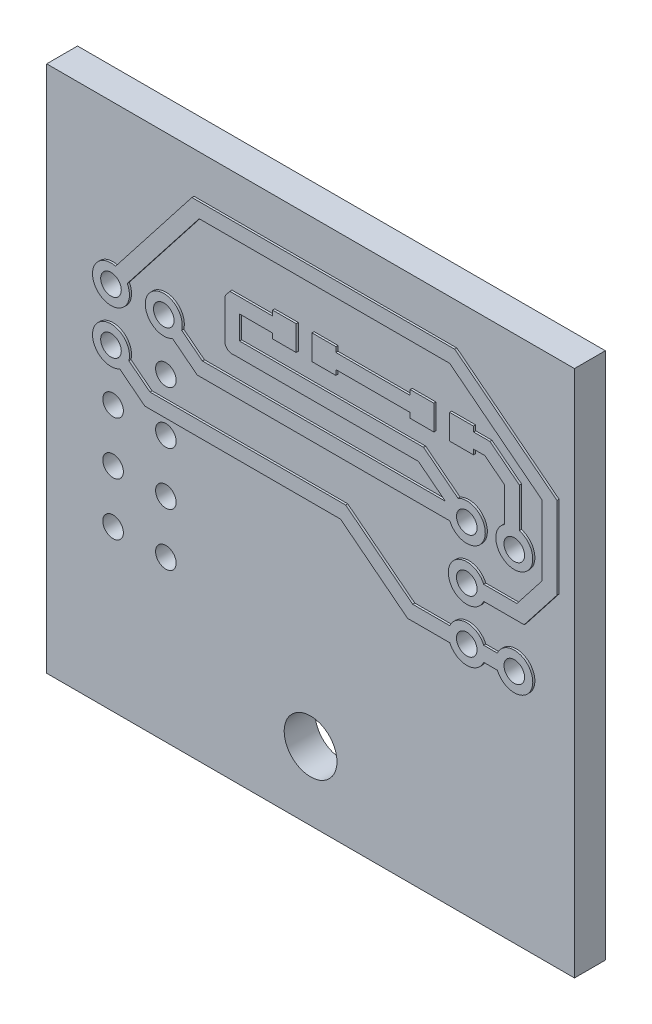
from build123d import *

# Parameters (mm, degrees)
SKETCH1_W           = 25.4
SKETCH1_H           = 25.4
BOSS_EXTRUDE1_DEPTH = 1.5875
SKETCH2_R           = 0.4953
CUT_EXTRUDE1_DEPTH  = 2.54
SKETCH4_R           = 0.4953
CUT_EXTRUDE2_DEPTH  = 2.54
SKETCH5_W           = 25.4
SKETCH5_H           = 25.4
SKETCH5_R           = 0.4953
CUT_EXTRUDE4_DEPTH  = 0.1016
SKETCH6_R           = 1.27
CUT_EXTRUDE5_DEPTH  = 2.54


with BuildPart() as part:
    # Sketch1 → Boss-Extrude1 (new body)
    with BuildSketch(Plane.XY):
        Rectangle(SKETCH1_W, SKETCH1_H)
    extrude(amount=BOSS_EXTRUDE1_DEPTH)

    # Sketch2 → Cut-Extrude1 (cut)
    with BuildSketch(Plane.XY.offset(1.5875)):
        with Locations((-9.503137046, 5.16324298)):
            Circle(SKETCH2_R)
        with Locations((-6.963137046, 5.16324298)):
            Circle(SKETCH2_R)
        with Locations((-9.503137046, 2.62324298)):
            Circle(SKETCH2_R)
        with Locations((-6.963137046, 2.62324298)):
            Circle(SKETCH2_R)
        with Locations((-9.503137046, 0.08324298)):
            Circle(SKETCH2_R)
        with Locations((-6.963137046, 0.08324298)):
            Circle(SKETCH2_R)
        with Locations((-9.503137046, -2.45675702)):
            Circle(SKETCH2_R)
        with Locations((-6.963137046, -2.45675702)):
            Circle(SKETCH2_R)
        with Locations((-9.503137046, -4.99675702)):
            Circle(SKETCH2_R)
        with Locations((-6.963137046, -4.99675702)):
            Circle(SKETCH2_R)
    extrude(amount=-CUT_EXTRUDE1_DEPTH, mode=Mode.SUBTRACT)

    # Sketch4 → Cut-Extrude2 (cut)
    with BuildSketch(Plane.XY.offset(1.5875)):
        with Locations((7.62, 3.81)):
            Circle(SKETCH4_R)
        with Locations((7.62, 1.27)):
            Circle(SKETCH4_R)
        with Locations((7.62, -1.27)):
            Circle(SKETCH4_R)
        with Locations((9.906, -1.27)):
            Circle(SKETCH4_R)
        with Locations((9.906, 3.81)):
            Circle(SKETCH4_R)
    extrude(amount=-CUT_EXTRUDE2_DEPTH, mode=Mode.SUBTRACT)

    # Sketch5 → Cut-Extrude4 (cut)
    with BuildSketch(Plane.XY.offset(1.5875)):
        Rectangle(SKETCH5_W, SKETCH5_H)
        with BuildLine():
            Line((-5.260680936, 10.015749034), (-8.721290559, 5.586370704))
            ThreePointArc((-8.721290559, 5.586370704), (-10.050460097, 4.46270142), (-9.281723807, 6.024229146))
            Line((-9.281723807, 6.024229146), (-5.607556352, 10.726949034))
            Line((-5.607556352, 10.726949034), (7.041908164, 10.726949034))
            Line((7.041908164, 10.726949034), (11.959875981, 6.884611467))
            Line((11.959875981, 6.884611467), (11.959875981, 2.935863527))
            Line((11.959875981, 2.935863527), (10.380535583, 0.9144))
            Line((10.380535583, 0.9144), (8.434781959, 0.9144))
            ThreePointArc((8.434781959, 0.9144), (6.731, 1.27), (8.434781959, 1.6256))
            Line((8.434781959, 1.6256), (10.033660166, 1.6256))
            Line((10.033660166, 1.6256), (11.248675981, 3.180749326))
            Line((11.248675981, 3.180749326), (11.248675981, 6.53773605))
            Line((11.248675981, 6.53773605), (6.797022365, 10.015749034))
            Line((6.797022365, 10.015749034), (-5.260680936, 10.015749034))
        make_face(mode=Mode.SUBTRACT)
        with BuildLine():
            Line((-8.64215088, 2.401829741), (-7.627203971, 1.60886631))
            Line((-7.627203971, 1.60886631), (1.787159337, 1.60886631))
            Line((1.787159337, 1.60886631), (5.016792936, -0.9144))
            Line((5.016792936, -0.9144), (6.805218041, -0.9144))
            ThreePointArc((6.805218041, -0.9144), (7.62, -0.381), (8.434781959, -0.9144))
            Line((8.434781959, -0.9144), (9.091218041, -0.9144))
            ThreePointArc((9.091218041, -0.9144), (10.795, -1.27), (9.091218041, -1.6256))
            Line((9.091218041, -1.6256), (8.434781959, -1.6256))
            ThreePointArc((8.434781959, -1.6256), (7.62, -2.159), (6.805218041, -1.6256))
            Line((6.805218041, -1.6256), (4.771907137, -1.6256))
            Line((4.771907137, -1.6256), (1.542273539, 0.89766631))
            Line((1.542273539, 0.89766631), (-7.87208977, 0.89766631))
            Line((-7.87208977, 0.89766631), (-9.080009321, 1.841396493))
            ThreePointArc((-9.080009321, 1.841396493), (-10.203678606, 3.170566031), (-8.64215088, 2.401829741))
        make_face(mode=Mode.SUBTRACT)
        with BuildLine():
            Line((9.441579604, 4.622540959), (9.441579604, 6.272789394))
            Line((9.441579604, 6.272789394), (8.487506715, 7.018192829))
            Line((8.487506715, 7.018192829), (7.944356637, 7.018192829))
            Line((7.944356637, 7.018192829), (7.944356637, 6.773792829))
            Line((7.944356637, 6.773792829), (6.794350037, 6.773792829))
            Line((6.794350037, 6.773792829), (6.794350037, 7.973792829))
            Line((6.794350037, 7.973792829), (7.944356637, 7.973792829))
            Line((7.944356637, 7.973792829), (7.944356637, 7.729392829))
            Line((7.944356637, 7.729392829), (8.732392514, 7.729392829))
            Line((8.732392514, 7.729392829), (10.152779604, 6.619664811))
            Line((10.152779604, 6.619664811), (10.152779604, 4.718555699))
            ThreePointArc((10.152779604, 4.718555699), (10.024939422, 2.983486714), (9.441579604, 4.622540959))
        make_face(mode=Mode.SUBTRACT)
        with Locations((-6.963137046, 2.62324298)):
            Circle(SKETCH5_R, mode=Mode.SUBTRACT)
        with BuildLine():
            ThreePointArc((7.196872275, 4.591846487), (8.460566014, 3.520569911), (6.805218041, 3.4544))
            Line((6.805218041, 3.4544), (-5.353507917, 3.4544))
            Line((-5.353507917, 3.4544), (-6.540009321, 4.381396493))
            ThreePointArc((-6.540009321, 4.381396493), (-7.663678606, 5.710566031), (-6.10215088, 4.941829741))
            Line((-6.10215088, 4.941829741), (-5.108622118, 4.1656))
            Line((-5.108622118, 4.1656), (6.587262612, 4.1656))
            Line((6.587262612, 4.1656), (5.292598329, 5.177102595))
            Line((5.292598329, 5.177102595), (-3.586091983, 5.177102595))
            ThreePointArc((-3.586091983, 5.177102595), (-3.889470471, 5.243416559), (-4.025066715, 5.522790336))
            Line((-4.025066715, 5.522790336), (-4.025066715, 7.294419839))
            ThreePointArc((-4.025066715, 7.294419839), (-4.005693121, 7.410191875), (-3.949683339, 7.51334906))
            Line((-3.949683339, 7.51334906), (-3.780891448, 7.729392829))
            Line((-3.780891448, 7.729392829), (-1.732131499, 7.729392829))
            Line((-1.732131499, 7.729392829), (-1.732131499, 7.973792829))
            Line((-1.732131499, 7.973792829), (-0.592131499, 7.973792829))
            Line((-0.592131499, 7.973792829), (-0.592131499, 6.773792829))
            Line((-0.592131499, 6.773792829), (-1.732131499, 6.773792829))
            Line((-1.732131499, 6.773792829), (-1.732131499, 7.018192829))
            Line((-1.732131499, 7.018192829), (-3.313866715, 7.018192829))
            Line((-3.313866715, 7.018192829), (-3.313866715, 5.888302595))
            Line((-3.313866715, 5.888302595), (5.537484128, 5.888302595))
            Line((5.537484128, 5.888302595), (7.196872275, 4.591846487))
        make_face(mode=Mode.SUBTRACT)
        Polygon((4.894350037, 7.729392829), (4.894350037, 7.973792829), (6.034350037, 7.973792829), (6.034350037, 6.773792829), (4.894350037, 6.773792829), (4.894350037, 7.018192829), (1.317875101, 7.018192829), (1.317875101, 6.773792829), (0.167868501, 6.773792829), (0.167868501, 7.973792829), (1.317875101, 7.973792829), (1.317875101, 7.729392829), align=None, mode=Mode.SUBTRACT)
        with Locations((-6.963137046, -2.45675702)):
            Circle(SKETCH5_R, mode=Mode.SUBTRACT)
        with Locations((-9.503137046, 0.08324298)):
            Circle(SKETCH5_R, mode=Mode.SUBTRACT)
        with Locations((-6.963137046, 0.08324298)):
            Circle(SKETCH5_R, mode=Mode.SUBTRACT)
        with Locations((-9.503137046, -4.99675702)):
            Circle(SKETCH5_R, mode=Mode.SUBTRACT)
        with Locations((-6.963137046, -4.99675702)):
            Circle(SKETCH5_R, mode=Mode.SUBTRACT)
        with Locations((-9.503137046, -2.45675702)):
            Circle(SKETCH5_R, mode=Mode.SUBTRACT)
    extrude(amount=-CUT_EXTRUDE4_DEPTH, mode=Mode.SUBTRACT)

    # Sketch6 → Cut-Extrude5 (cut)
    with BuildSketch(Plane(origin=(0, 0, 0), x_dir=(-1, 0, 0), z_dir=(0, 0, -1))):
        with Locations((0, -9.398)):
            Circle(SKETCH6_R)
    extrude(amount=-CUT_EXTRUDE5_DEPTH, mode=Mode.SUBTRACT)


solid = part.part
